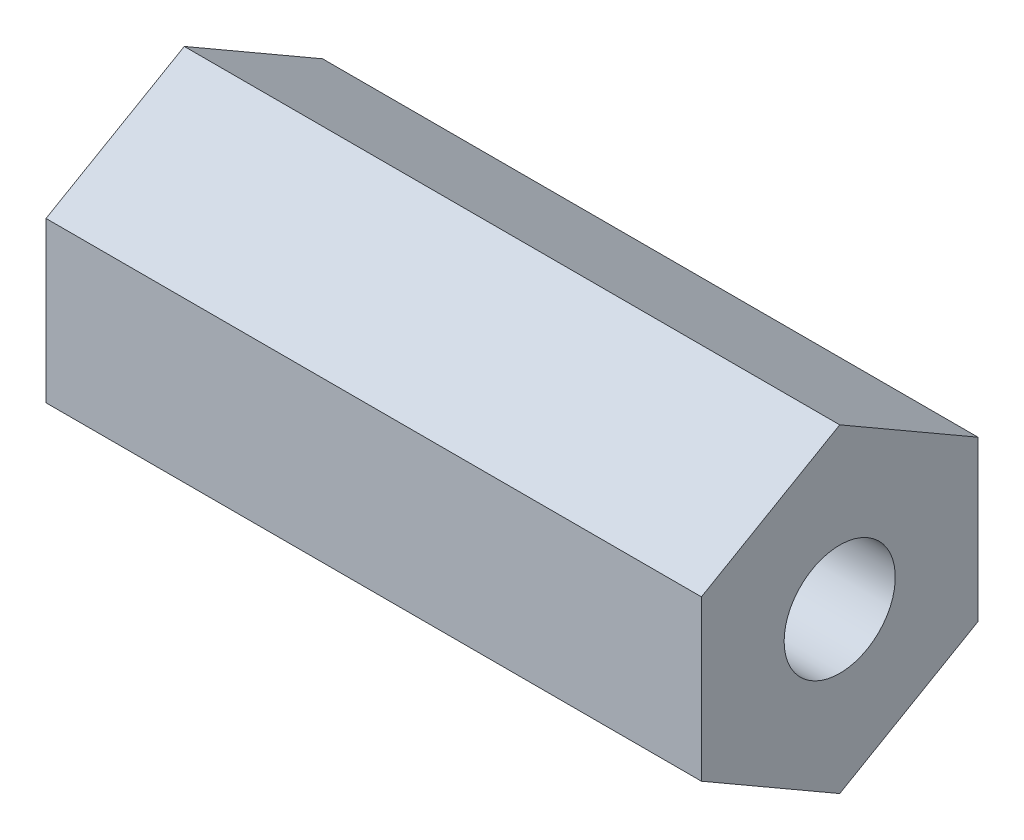
from build123d import *

# Parameters (mm, degrees)
SKETCH1_R           = 2.5527
BOSS_EXTRUDE1_DEPTH = 30.099


with BuildPart() as part:
    # Sketch1 → Boss-Extrude1 (new body)
    with BuildSketch(Plane(origin=(0, 0, 0), x_dir=(0, 0, -1), z_dir=(1, 0, 0))):
        Polygon((0, 7.332348419), (-6.35, 3.666174209), (-6.35, -3.666174209), (0, -7.332348419), (6.35, -3.666174209), (6.35, 3.666174209), align=None)
        with Locations(Location((0, 0, 0), (0, 0, 180))):
            Circle(SKETCH1_R, mode=Mode.SUBTRACT)
    extrude(amount=BOSS_EXTRUDE1_DEPTH)


solid = part.part
